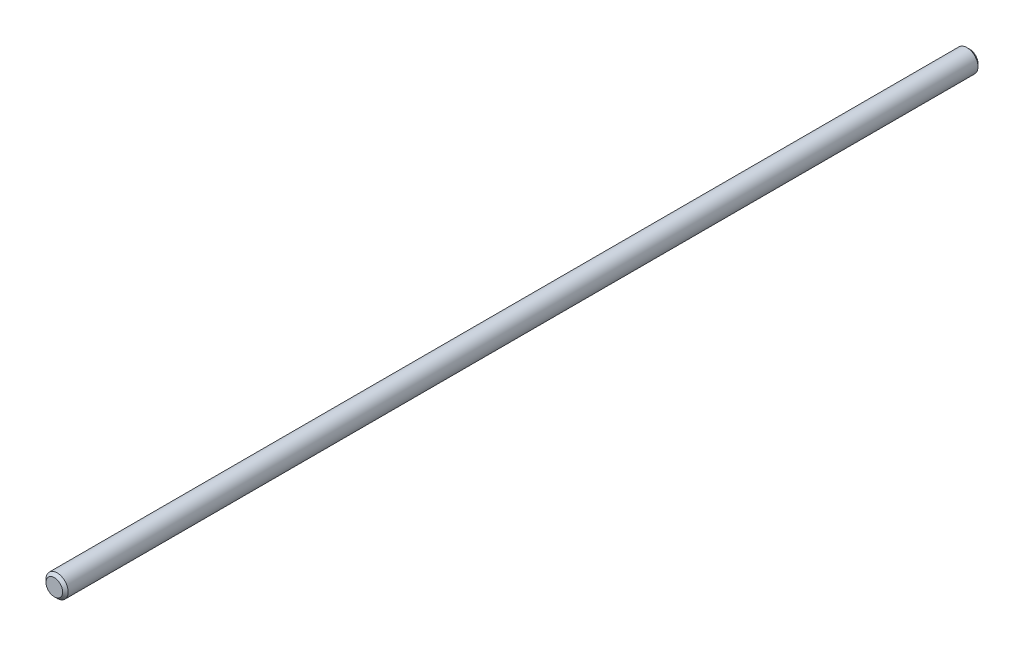
from build123d import *

# Parameters (mm, degrees)
SCHIZZO1_R                   = 4
ESTRUSIONE_ESTRUSIONE1_DEPTH = 330
SMUSSO1_SIZE                 = 1


with BuildPart() as part:
    # Schizzo1 → Estrusione-Estrusione1 (new body)
    with BuildSketch(Plane.XY):
        Circle(SCHIZZO1_R)
    extrude(amount=ESTRUSIONE_ESTRUSIONE1_DEPTH)

    # Smusso1
    smusso1_edges = [part.edges().sort_by_distance(p)[0] for p in [
        (-4, 0, 0),
        (-4, 0, 330),
    ]]
    chamfer(smusso1_edges, length=SMUSSO1_SIZE)


solid = part.part
